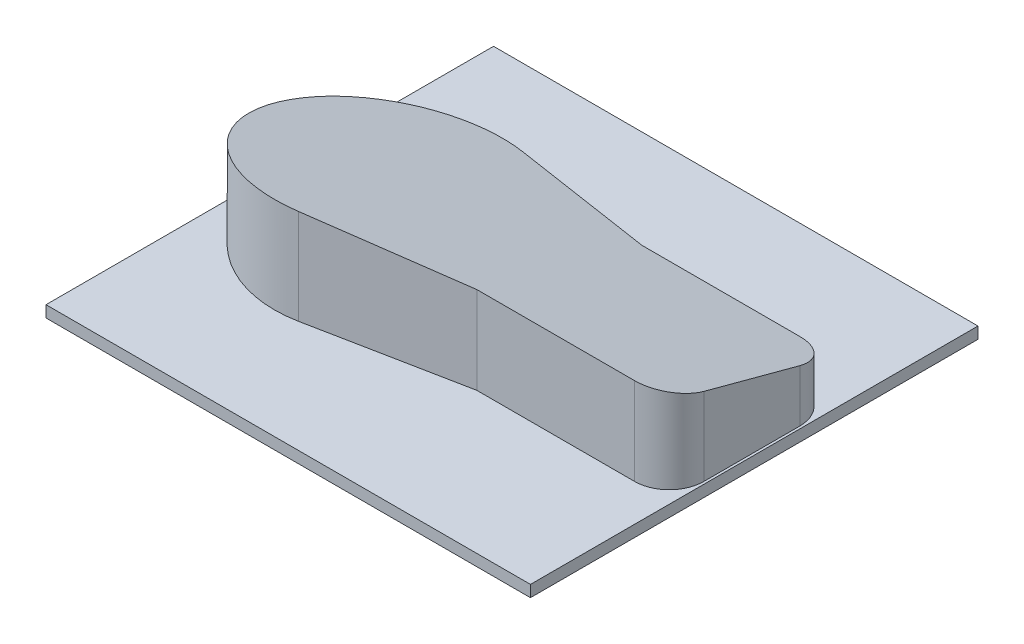
from build123d import *

# Parameters (mm, degrees)
SKETCH_1_W          = 210
SKETCH_1_H          = 194
EXTRUDE_1_DEPTH     = 5
EXTRUDE_2_DEPTH     = 50
CUT_EXTRUDE_1_DEPTH = 292.137424595
FILLET_1_R          = 15
CUT_EXTRUDE_2_DEPTH = 15
CUT_EXTRUDE_4_DEPTH = 5
CUT_EXTRUDE_6_REACH = 289.625


with BuildPart() as part:
    # 草图1 → 凸台-拉伸1 (new body)
    with BuildSketch(Plane(origin=(0, 0, 0), x_dir=(1, 0, 0), z_dir=(0, 1, 0))):
        with Locations((105, -97)):
            Rectangle(SKETCH_1_W, SKETCH_1_H)
    extrude(amount=EXTRUDE_1_DEPTH)

    # 草图2 → 凸台-拉伸2 (add)
    with BuildSketch(Plane(origin=(0, 5, 0), x_dir=(1, 0, 0), z_dir=(0, 1, 0))):
        with BuildLine():
            Line((125.513628731, -61.215495335), (208.95, -61.215495335))
            Line((208.95, -61.215495335), (208.95, -132.784504665))
            Line((208.95, -132.784504665), (125.513628731, -132.784504665))
            Line((125.513628731, -132.784504665), (61.026324627, -145.513879526))
            ThreePointArc((61.026324627, -145.513879526), (2, -97), (61.026324627, -48.486120474))
            Line((61.026324627, -48.486120474), (125.513628731, -61.215495335))
        make_face()
    extrude(amount=EXTRUDE_2_DEPTH)

    # 草图3 → 切除-拉伸1 (cut, through all)
    with BuildSketch(Plane.ZY):
        Polygon((146.45, 46.500175131), (146.45, 55), (47.55, 55), (47.55, 20), align=None)
    extrude(amount=-CUT_EXTRUDE_1_DEPTH, mode=Mode.SUBTRACT)

    # 圆角1
    fillet_1_edges = [part.edges().sort_by_distance(p)[0] for p in [
        (208.95, 14.33082922, 61.215495335),
        (208.95, 23.919258346, 132.784504665),
    ]]
    fillet(fillet_1_edges, radius=FILLET_1_R)

    # 草图5 → 切除-拉伸2 (cut)
    with BuildSketch(Plane.XZ):
        with BuildLine():
            Line((124.536092452, 122.784504665), (59.089757463, 135.703185992))
            ThreePointArc((59.089757463, 135.703185992), (12, 97), (59.089757463, 58.296814008))
            Line((59.089757463, 58.296814008), (124.536092452, 71.215495335))
            Line((124.536092452, 71.215495335), (193.95, 71.215495335))
            ThreePointArc((193.95, 71.215495335), (197.485533906, 72.679961429), (198.95, 76.215495335))
            Line((198.95, 76.215495335), (198.95, 117.784504665))
            ThreePointArc((198.95, 117.784504665), (197.485533906, 121.320038571), (193.95, 122.784504665))
            Line((193.95, 122.784504665), (124.536092452, 122.784504665))
        make_face()
    extrude(amount=-CUT_EXTRUDE_2_DEPTH, mode=Mode.SUBTRACT)

    # 草图7 → 切除-拉伸4 (cut)
    with BuildSketch(Plane(origin=(0, 1.943124906, -0.520658749), x_dir=(1, 0, 0), z_dir=(0, 0.9659258262890681, -0.25881904510252174))):
        with BuildLine():
            Line((124.502295526, -129.347406371), (193.95, -129.347406371))
            add(Edge.make_bspline(
                [(193.95, -129.347406371), (194.562427767, -129.347406371), (195.774611757, -129.102068407), (197.439735395, -127.969946536), (198.650781168, -126.127504684), (198.95, -124.574413564), (198.95, -123.818263665)],
                knots=[-3.141592654, -3.141592654, -3.141592654, -3.141592654, -2.748893572, -2.35619449, -1.963495408, -1.570796327, -1.570796327, -1.570796327, -1.570796327], degree=3))
            Line((198.95, -123.818263665), (198.95, -80.782858462))
            add(Edge.make_bspline(
                [(198.95, -80.782858462), (198.95, -80.026708563), (198.650781168, -78.473617443), (197.439735395, -76.631175591), (195.774611757, -75.49905372), (194.562427767, -75.253715756), (193.95, -75.253715756)],
                knots=[-1.570796327, -1.570796327, -1.570796327, -1.570796327, -1.178097245, -0.785398163, -0.392699082, 0, 0, 0, 0], degree=3))
            Line((193.95, -75.253715756), (124.502295526, -75.253715756))
            Line((124.502295526, -75.253715756), (59.024136493, -61.872809237))
            add(Edge.make_bspline(
                [(59.024136493, -61.872809237), (56.210095744, -61.297740897), (50.427971911, -60.789688878), (38.964091843, -62.413259275), (25.731264842, -69.297623809), (14.654919531, -83.972220417), (10.672540234, -102.300561063), (14.654919531, -120.628901709), (25.731264842, -135.303498318), (38.964091843, -142.187862851), (50.427971911, -143.811433248), (56.210095744, -143.30338123), (59.024136493, -142.72831289)],
                knots=[-0.194888061, -0.194888061, -0.194888061, -0.194888061, 0.025822487, 0.246533036, 0.687954133, 1.12937523, 1.570796327, 2.012217424, 2.453638521, 2.895059618, 3.115770166, 3.336480715, 3.336480715, 3.336480715, 3.336480715], degree=3))
            Line((59.024136493, -142.72831289), (124.502295526, -129.347406371))
        make_face()
    extrude(amount=-CUT_EXTRUDE_4_DEPTH, mode=Mode.SUBTRACT)

    # 切除-拉伸6: up to this face of the body (flat: up to its plane)
    cut_extrude_6_end = Plane(part.part.faces().sort_by_distance((100.607454563, 28.420458434, 98.294095226))[0])
    # 草图8 → 切除-拉伸6 (cut, up to the picked face)
    with BuildSketch(Plane.XZ.offset(-15), mode=Mode.PRIVATE) as cut_extrude_6_sk1:
        with BuildLine():
            Line((193.95, 122.784504665), (124.536092452, 122.784504665))
            Line((124.536092452, 122.784504665), (59.089757463, 135.703185992))
            ThreePointArc((59.089757463, 135.703185992), (12, 97), (59.089757463, 58.296814008))
            Line((59.089757463, 58.296814008), (124.536092452, 71.215495335))
            Line((124.536092452, 71.215495335), (193.95, 71.215495335))
            ThreePointArc((193.95, 71.215495335), (197.485533906, 72.679961429), (198.95, 76.215495335))
            Line((198.95, 76.215495335), (198.95, 117.784504665))
            ThreePointArc((198.95, 117.784504665), (197.485533906, 121.320038571), (193.95, 122.784504665))
        make_face()
    cut_extrude_6_tool1 = split(extrude(cut_extrude_6_sk1.sketch, amount=-CUT_EXTRUDE_6_REACH, mode=Mode.PRIVATE), bisect_by=cut_extrude_6_end, keep=Keep.BOTH, mode=Mode.PRIVATE)
    add(cut_extrude_6_tool1.solids().sort_by(Axis((100.513282, 15, 97), (0, 1, 0)))[0], mode=Mode.SUBTRACT)


solid = part.part
